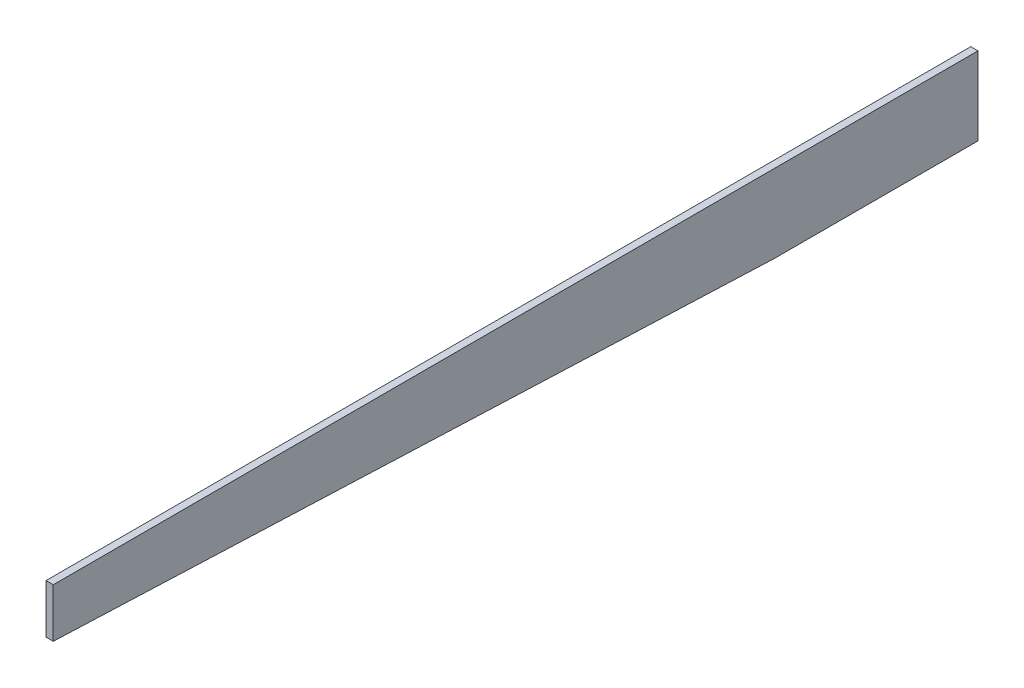
from build123d import *

# Parameters (mm, degrees)
BOSS_EXTRUDE1_DEPTH = 3


with BuildPart() as part:
    # Sketch1 → Boss-Extrude1 (new body)
    with BuildSketch(Plane(origin=(0, 0, 0), x_dir=(0, 0, -1), z_dir=(1, 0, 0))):
        Polygon((-383, 12.016330065), (-84.3, 0), (0, 0), (0, 32.31), (-383, 32.31), align=None)
    extrude(amount=BOSS_EXTRUDE1_DEPTH)


solid = part.part
